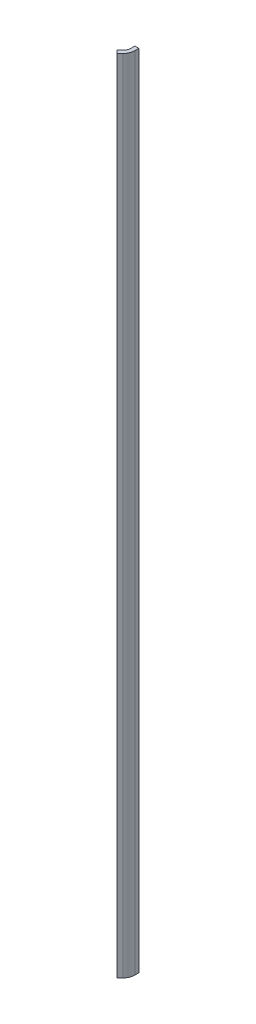
from build123d import *

# Parameters (mm, degrees)
BOSS_EXTRUDE3_DEPTH = 400


with BuildPart() as part:
    # Sketch1 → Boss-Extrude3 (new body)
    with BuildSketch(Plane(origin=(0, 0, 0), x_dir=(1, 0, 0), z_dir=(0, 1, 0))):
        with BuildLine():
            Line((61.414213562, -40.144578291), (62.828427125, -38.730364729))
            ThreePointArc((62.828427125, -38.730364729), (63.69551813, -37.432671334), (64, -35.901937604))
            Line((64, -35.901937604), (64, -33.901937604))
            Line((64, -33.901937604), (66, -33.901937604))
            Line((66, -33.901937604), (66, -35.901937604))
            ThreePointArc((66, -35.901937604), (65.543277195, -38.198038199), (64.242640687, -40.144578291))
            Line((64.242640687, -40.144578291), (62.828427125, -41.558791854))
            Line((62.828427125, -41.558791854), (61.414213562, -40.144578291))
        make_face()
    extrude(amount=BOSS_EXTRUDE3_DEPTH)


solid = part.part
